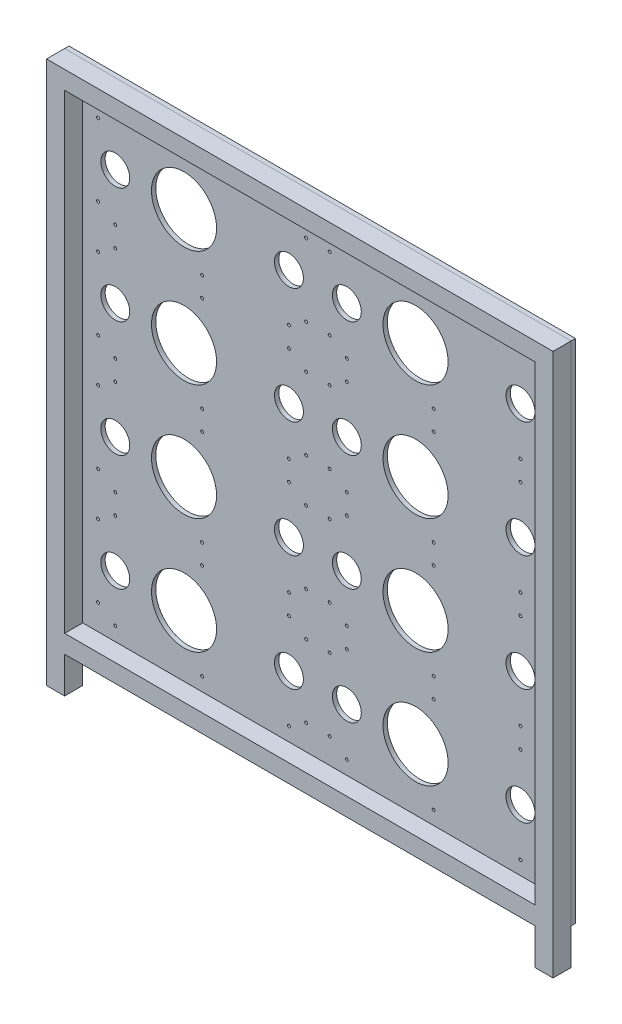
from build123d import *

# Parameters (mm, degrees)
SKETCH8_W           = 700
SKETCH8_H           = 700
BOSS_EXTRUDE7_DEPTH = 6
SKETCH5_W           = 650
SKETCH5_H           = 650
BOSS_EXTRUDE8_DEPTH = 25
SKETCH4_R           = 2
SKETCH4_R_2         = 20
SKETCH4_R_3         = 45
CUT_EXTRUDE1_DEPTH  = 533.094916345


with BuildPart() as part:
    # Sketch8 → Boss-Extrude7 (new body)
    with BuildSketch(Plane.XY):
        Rectangle(SKETCH8_W, SKETCH8_H)
    extrude(amount=-BOSS_EXTRUDE7_DEPTH)

    # Sketch4 → Cut-Extrude1 (cut, through all)
    with BuildSketch(Plane.XY):
        with Locations((-303.75, 290)):
            Circle(SKETCH4_R)
        with Locations((-303.75, 190)):
            Circle(SKETCH4_R)
        with Locations((-160, 306.25)):
            Circle(SKETCH4_R)
        with Locations((-16.25, 290)):
            Circle(SKETCH4_R)
        with Locations((-160, 173.75)):
            Circle(SKETCH4_R)
        with Locations((-16.25, 190)):
            Circle(SKETCH4_R)
        with Locations((-280, 174)):
            Circle(SKETCH4_R)
        with Locations((-280, 306)):
            Circle(SKETCH4_R)
        with Locations((-40, 306)):
            Circle(SKETCH4_R)
        with Locations((-40, 174)):
            Circle(SKETCH4_R)
        with Locations((40, 174)):
            Circle(SKETCH4_R)
        with Locations((16.25, 190)):
            Circle(SKETCH4_R)
        with Locations((40, 240)):
            Circle(SKETCH4_R_2)
        with Locations((16.25, 290)):
            Circle(SKETCH4_R)
        with Locations((40, 306)):
            Circle(SKETCH4_R)
        with Locations((135, 240)):
            Circle(SKETCH4_R_3)
        with Locations((160, 306.25)):
            Circle(SKETCH4_R)
        with Locations((160, 173.75)):
            Circle(SKETCH4_R)
        with Locations((280, 174)):
            Circle(SKETCH4_R)
        with Locations((303.75, 190)):
            Circle(SKETCH4_R)
        with Locations((280, 240)):
            Circle(SKETCH4_R_2)
        with Locations((280, 306)):
            Circle(SKETCH4_R)
        with Locations((303.75, 290)):
            Circle(SKETCH4_R)
        with Locations((40, 14)):
            Circle(SKETCH4_R)
        with Locations((16.25, 30)):
            Circle(SKETCH4_R)
        with Locations((40, 80)):
            Circle(SKETCH4_R_2)
        with Locations((16.25, 130)):
            Circle(SKETCH4_R)
        with Locations((40, 146)):
            Circle(SKETCH4_R)
        with Locations((135, 80)):
            Circle(SKETCH4_R_3)
        with Locations((160, 146.25)):
            Circle(SKETCH4_R)
        with Locations((160, 13.75)):
            Circle(SKETCH4_R)
        with Locations((280, 14)):
            Circle(SKETCH4_R)
        with Locations((303.75, 30)):
            Circle(SKETCH4_R)
        with Locations((280, 80)):
            Circle(SKETCH4_R_2)
        with Locations((280, 146)):
            Circle(SKETCH4_R)
        with Locations((303.75, 130)):
            Circle(SKETCH4_R)
        with Locations((40, -146)):
            Circle(SKETCH4_R)
        with Locations((16.25, -130)):
            Circle(SKETCH4_R)
        with Locations((40, -80)):
            Circle(SKETCH4_R_2)
        with Locations((16.25, -30)):
            Circle(SKETCH4_R)
        with Locations((40, -14)):
            Circle(SKETCH4_R)
        with Locations((135, -80)):
            Circle(SKETCH4_R_3)
        with Locations((160, -13.75)):
            Circle(SKETCH4_R)
        with Locations((160, -146.25)):
            Circle(SKETCH4_R)
        with Locations((280, -146)):
            Circle(SKETCH4_R)
        with Locations((303.75, -130)):
            Circle(SKETCH4_R)
        with Locations((280, -80)):
            Circle(SKETCH4_R_2)
        with Locations((280, -14)):
            Circle(SKETCH4_R)
        with Locations((-280, 240)):
            Circle(SKETCH4_R_2)
        with Locations((-185, 240)):
            Circle(SKETCH4_R_3)
        with Locations((-40, 240)):
            Circle(SKETCH4_R_2)
        with Locations((303.75, -30)):
            Circle(SKETCH4_R)
        with Locations((40, -306)):
            Circle(SKETCH4_R)
        with Locations((16.25, -290)):
            Circle(SKETCH4_R)
        with Locations((40, -240)):
            Circle(SKETCH4_R_2)
        with Locations((16.25, -190)):
            Circle(SKETCH4_R)
        with Locations((40, -174)):
            Circle(SKETCH4_R)
        with Locations((135, -240)):
            Circle(SKETCH4_R_3)
        with Locations((160, -173.75)):
            Circle(SKETCH4_R)
        with Locations((160, -306.25)):
            Circle(SKETCH4_R)
        with Locations((280, -306)):
            Circle(SKETCH4_R)
        with Locations((303.75, -290)):
            Circle(SKETCH4_R)
        with Locations((280, -240)):
            Circle(SKETCH4_R_2)
        with Locations((280, -174)):
            Circle(SKETCH4_R)
        with Locations((303.75, -190)):
            Circle(SKETCH4_R)
        with Locations((-280, 14)):
            Circle(SKETCH4_R)
        with Locations((-303.75, 30)):
            Circle(SKETCH4_R)
        with Locations((-280, 80)):
            Circle(SKETCH4_R_2)
        with Locations((-303.75, 130)):
            Circle(SKETCH4_R)
        with Locations((-280, 146)):
            Circle(SKETCH4_R)
        with Locations((-185, 80)):
            Circle(SKETCH4_R_3)
        with Locations((-160, 146.25)):
            Circle(SKETCH4_R)
        with Locations((-160, 13.75)):
            Circle(SKETCH4_R)
        with Locations((-40, 14)):
            Circle(SKETCH4_R)
        with Locations((-16.25, 30)):
            Circle(SKETCH4_R)
        with Locations((-40, 80)):
            Circle(SKETCH4_R_2)
        with Locations((-40, 146)):
            Circle(SKETCH4_R)
        with Locations((-16.25, 130)):
            Circle(SKETCH4_R)
        with Locations((-280, -146)):
            Circle(SKETCH4_R)
        with Locations((-303.75, -130)):
            Circle(SKETCH4_R)
        with Locations((-280, -80)):
            Circle(SKETCH4_R_2)
        with Locations((-303.75, -30)):
            Circle(SKETCH4_R)
        with Locations((-280, -14)):
            Circle(SKETCH4_R)
        with Locations((-185, -80)):
            Circle(SKETCH4_R_3)
        with Locations((-160, -13.75)):
            Circle(SKETCH4_R)
        with Locations((-160, -146.25)):
            Circle(SKETCH4_R)
        with Locations((-40, -146)):
            Circle(SKETCH4_R)
        with Locations((-16.25, -130)):
            Circle(SKETCH4_R)
        with Locations((-40, -80)):
            Circle(SKETCH4_R_2)
        with Locations((-40, -14)):
            Circle(SKETCH4_R)
        with Locations((-16.25, -30)):
            Circle(SKETCH4_R)
        with Locations((-280, -306)):
            Circle(SKETCH4_R)
        with Locations((-303.75, -290)):
            Circle(SKETCH4_R)
        with Locations((-280, -240)):
            Circle(SKETCH4_R_2)
        with Locations((-303.75, -190)):
            Circle(SKETCH4_R)
        with Locations((-280, -174)):
            Circle(SKETCH4_R)
        with Locations((-185, -240)):
            Circle(SKETCH4_R_3)
        with Locations((-160, -173.75)):
            Circle(SKETCH4_R)
        with Locations((-160, -306.25)):
            Circle(SKETCH4_R)
        with Locations((-40, -306)):
            Circle(SKETCH4_R)
        with Locations((-16.25, -290)):
            Circle(SKETCH4_R)
        with Locations((-40, -240)):
            Circle(SKETCH4_R_2)
        with Locations((-40, -174)):
            Circle(SKETCH4_R)
        with Locations((-16.25, -190)):
            Circle(SKETCH4_R)
    extrude(amount=-CUT_EXTRUDE1_DEPTH, mode=Mode.SUBTRACT)


with BuildPart() as body_2:
    # Sketch5 → Boss-Extrude8 (new body)
    with BuildSketch(Plane.XY):
        Polygon((-350, 350), (350, 350), (350, -400), (325, -400), (325, -350), (-325, -350), (-325, -400), (-350, -400), align=None)
        Rectangle(SKETCH5_W, SKETCH5_H, mode=Mode.SUBTRACT)
    extrude(amount=BOSS_EXTRUDE8_DEPTH)


solid = Compound([part.part, body_2.part])
